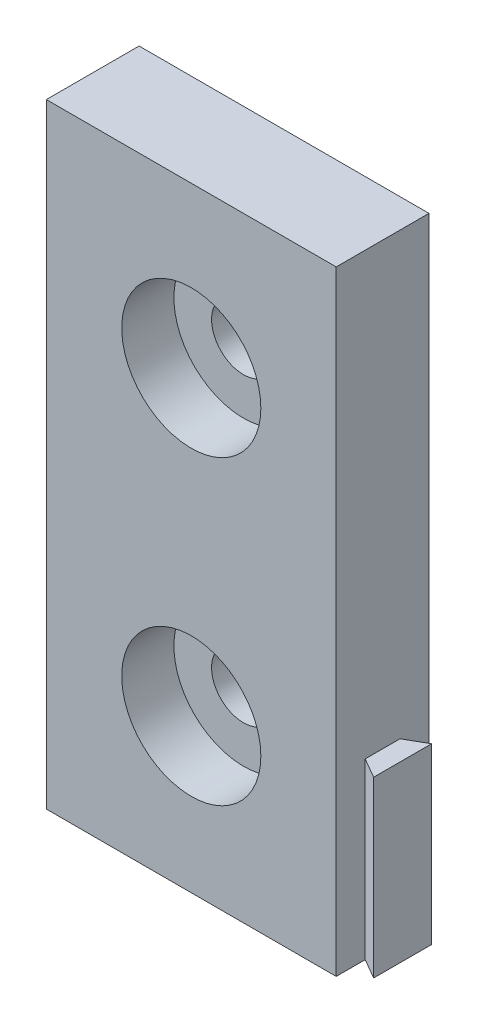
from build123d import *

# Parameters (mm, degrees)
SKETCH2_W           = 25
SKETCH2_H           = 53
SKETCH2_R           = 2.75
BOSS_EXTRUDE1_DEPTH = 8
BOSS_EXTRUDE2_DEPTH = 15
SKETCH4_R           = 6
CUT_EXTRUDE1_DEPTH  = 4.5


with BuildPart() as part:
    # Sketch2 → Boss-Extrude1 (new body)
    with BuildSketch(Plane.XY):
        with Locations((12.5, 26.5)):
            Rectangle(SKETCH2_W, SKETCH2_H)
        with Locations((12.5, 39.2)):
            Circle(SKETCH2_R, mode=Mode.SUBTRACT)
        with Locations((12.5, 13.2)):
            Circle(SKETCH2_R, mode=Mode.SUBTRACT)
    extrude(amount=BOSS_EXTRUDE1_DEPTH)

    # Sketch3 → Boss-Extrude2 (add)
    with BuildSketch(Plane.XZ):
        Polygon((25, 2.5), (26.732050808, 1.5), (26.732050808, 6.5), (25, 5.5), align=None)
    extrude(amount=-BOSS_EXTRUDE2_DEPTH)

    # Sketch4 → Cut-Extrude1 (cut)
    with BuildSketch(Plane.XY.offset(8)):
        with Locations((12.5, 39.2)):
            Circle(SKETCH4_R)
        with Locations((12.5, 13.2)):
            Circle(SKETCH4_R)
    extrude(amount=-CUT_EXTRUDE1_DEPTH, mode=Mode.SUBTRACT)


solid = part.part
